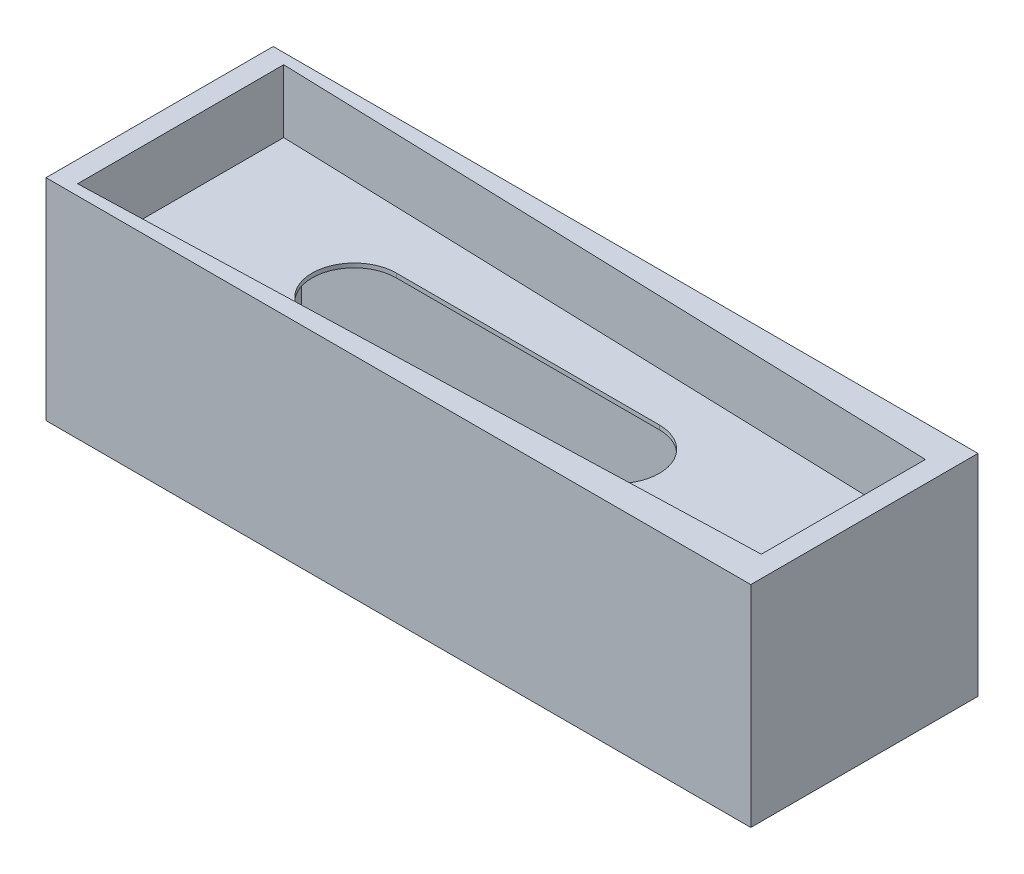
from build123d import *

# Parameters (mm, degrees)
SKETCH2_W           = 335
SKETCH2_H           = 108
BOSS_EXTRUDE4_DEPTH = 100
CUT_EXTRUDE1_DEPTH  = 30
SKETCH4_W           = 300
SKETCH4_H           = 100
CUT_EXTRUDE2_DEPTH  = 68
CUT_EXTRUDE3_DEPTH  = 31


with BuildPart() as part:
    # Sketch2 → Boss-Extrude4 (new body)
    with BuildSketch(Plane(origin=(0, 0, 0), x_dir=(1, 0, 0), z_dir=(0, 1, 0))):
        Rectangle(SKETCH2_W, SKETCH2_H)
    extrude(amount=-BOSS_EXTRUDE4_DEPTH)

    # Sketch3 → Cut-Extrude1 (cut)
    with BuildSketch(Plane(origin=(0, 0, 0), x_dir=(1, 0, 0), z_dir=(0, 1, 0))):
        Polygon((-157.5, -49), (-157.5, 49), (157.5, 39), (157.5, -39), align=None)
    extrude(amount=-CUT_EXTRUDE1_DEPTH, mode=Mode.SUBTRACT)

    # Sketch4 → Cut-Extrude2 (cut)
    with BuildSketch(Plane(origin=(0, -100, 0), x_dir=(-1, 0, 0), z_dir=(0, -1, 0))):
        Rectangle(SKETCH4_W, SKETCH4_H)
    extrude(amount=-CUT_EXTRUDE2_DEPTH, mode=Mode.SUBTRACT)

    # Sketch5 → Cut-Extrude3 (cut)
    with BuildSketch(Plane(origin=(0, -30, 0), x_dir=(1, 0, 0), z_dir=(0, 1, 0))):
        with BuildLine():
            Line((-75, 20), (50, 20))
            ThreePointArc((50, 20), (70, 0), (50, -20))
            Line((50, -20), (-75, -20))
            ThreePointArc((-75, -20), (-95, 0), (-75, 20))
        make_face()
    extrude(amount=-CUT_EXTRUDE3_DEPTH, mode=Mode.SUBTRACT)


solid = part.part
